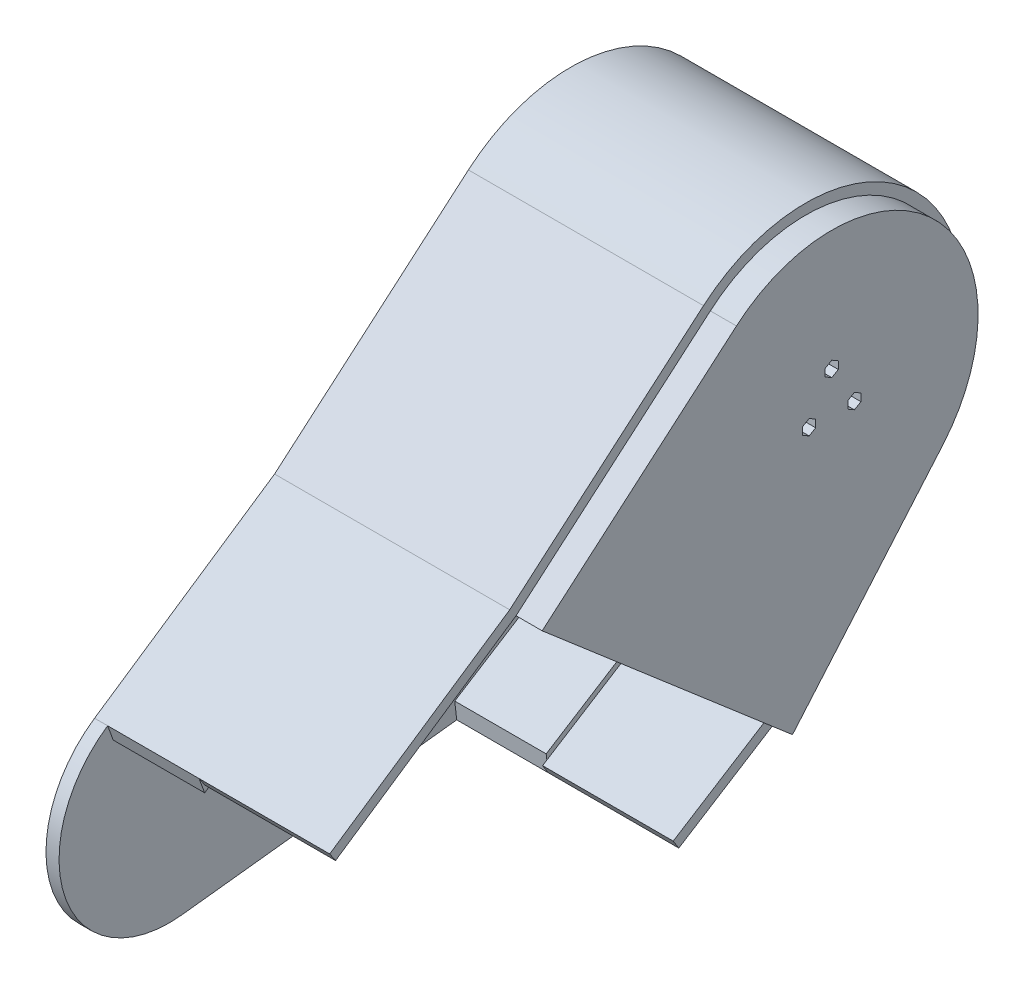
from build123d import *

# Parameters (mm, degrees)
EXTRUDE_1_DEPTH      = 40
CUT_EXTRUDE_4_DEPTH  = 35
SKETCH_7_W           = 35
SKETCH_7_H           = 105.918756423
CUT_EXTRUDE_5_DEPTH  = 15
CUT_EXTRUDE_START    = -35
CUT_EXTRUDE_9_DEPTH  = 35
CUT_EXTRUDE_10_DEPTH = 35
CUT_EXTRUDE_11_DEPTH = 10
EXTRUDE_1_2_DEPTH    = 50
EXTRUDE_2_DEPTH      = 10
CUT_EXTRUDE_12_DEPTH = 5


with BuildPart() as part:
    # 草图3 → Extrude 1 (new body)
    with BuildSketch(Plane(origin=(0, 0, 0), x_dir=(0, 0, -1), z_dir=(1, 0, 0))):
        with BuildLine():
            Line((-39.095806766, 45.513930761), (-113.284374472, -18.21297348))
            Line((-113.284374472, -18.21297348), (-182.19003676, -64.697864694))
            ThreePointArc((-182.19003676, -64.697864694), (-198.176247728, -114.294556788), (-153.795474112, -141.602755941))
            Line((-153.795474112, -141.602755941), (-48.562971232, -129.565177285))
            Line((-48.562971232, -129.565177285), (-12.389530407, -106.789307136))
            Line((-12.389530407, -106.789307136), (45.595100093, -39.001113414))
            ThreePointArc((45.595100093, -39.001113414), (42.382288475, 42.470479437), (-39.095806766, 45.513930761))
        make_face()
    extrude(amount=EXTRUDE_1_DEPTH)

    # 草图6 → 切除-拉伸4 (cut)
    with BuildSketch(Plane(origin=(40, 0, 0), x_dir=(0, 0, -1), z_dir=(1, 0, 0))):
        with BuildLine():
            Line((-35.186226089, 40.962537685), (-109.639530952, -22.991771937))
            Line((-109.639530952, -22.991771937), (-178.834510467, -69.671841302))
            ThreePointArc((-178.834510467, -69.671841302), (-192.547642974, -112.216382465), (-154.477369126, -135.641630276))
            Line((-154.477369126, -135.641630276), (-50.603031616, -123.759412579))
            Line((-50.603031616, -123.759412579), (-16.357071017, -102.19714109))
            Line((-16.357071017, -102.19714109), (41.035590084, -35.101002072))
            ThreePointArc((41.035590084, -35.101002072), (38.144059628, 38.223431493), (-35.186226089, 40.962537685))
        make_face()
    extrude(amount=-CUT_EXTRUDE_4_DEPTH, mode=Mode.SUBTRACT)

    # 草图7 → 切除-拉伸5 (cut)
    with BuildSketch(Plane(origin=(0, -122.40831364, -14.002324977), x_dir=(-1, 0, 0), z_dir=(0, -0.9935209441032395, -0.11364916906078788))):
        with Locations((-22.5, -115.932681977)):
            Rectangle(SKETCH_7_W, SKETCH_7_H)
    extrude(amount=-CUT_EXTRUDE_5_DEPTH, mode=Mode.SUBTRACT)

    # 草图10 → 切除-拉伸9 (cut)
    with BuildSketch(Plane(origin=(40, 0, 0), x_dir=(0, 0, -1), z_dir=(1, 0, 0)).offset(CUT_EXTRUDE_START)):
        with BuildLine():
            Line((-182.19003676, -64.697864694), (-153.795474112, -141.602755941))
            ThreePointArc((-153.795474112, -141.602755941), (-198.176247728, -114.294556788), (-182.19003676, -64.697864694))
        make_face()
    extrude(amount=CUT_EXTRUDE_9_DEPTH, mode=Mode.SUBTRACT)

    # 草图11 → 切除-拉伸10 (cut)
    with BuildSketch(Plane(origin=(40, 0, 0), x_dir=(0, 0, -1), z_dir=(1, 0, 0))):
        with BuildLine():
            Line((-153.795474112, -141.602755941), (-155.945574258, -135.779344608))
            ThreePointArc((-155.945574258, -135.779344608), (-155.210770318, -135.717964955), (-154.477369126, -135.641630276))
            Line((-154.477369126, -135.641630276), (-153.795474112, -141.602755941))
        make_face()
    extrude(amount=-CUT_EXTRUDE_10_DEPTH, mode=Mode.SUBTRACT)

    # 草图12 → 切除-拉伸11 (cut)
    with BuildSketch(Plane.ZY):
        with BuildLine():
            ThreePointArc((84.793520473, -96.572189119), (99.745010507, -105.858971316), (116.884057166, -101.853417992))
            ThreePointArc((116.884057166, -101.853417992), (118.032316505, -94.876205046), (111.055103559, -93.727945707))
            ThreePointArc((111.055103559, -93.727945707), (101.368894437, -95.991702141), (92.918992758, -90.743235512))
            ThreePointArc((92.918992758, -90.743235512), (85.941779812, -89.594976173), (84.793520473, -96.572189119))
        make_face()
    extrude(amount=-CUT_EXTRUDE_11_DEPTH, mode=Mode.SUBTRACT)

    # 草图14 → Extrude 1 2 (add)
    with BuildSketch(Plane(origin=(40, 0, 0), x_dir=(0, 0, -1), z_dir=(1, 0, 0))):
        with BuildLine():
            Line((-49.319536319, -122.95128591), (-16.357071017, -102.19714109))
            Line((-16.357071017, -102.19714109), (41.035590084, -35.101002072))
            ThreePointArc((41.035590084, -35.101002072), (38.144059628, 38.223431493), (-35.186226089, 40.962537685))
            Line((-35.186226089, 40.962537685), (-109.639530952, -22.991771937))
            Line((-109.639530952, -22.991771937), (-178.834510467, -69.671841302))
            Line((-178.834510467, -69.671841302), (-176.597492938, -72.987825708))
            Line((-176.597492938, -72.987825708), (-107.209635272, -26.177637574))
            Line((-107.209635272, -26.177637574), (-32.579838971, 37.928275634))
            ThreePointArc((-32.579838971, 37.928275634), (35.31857373, 35.392066197), (37.995916744, -32.500927845))
            Line((37.995916744, -32.500927845), (-19.00209809, -99.13569706))
            Line((-19.00209809, -99.13569706), (-51.450789398, -119.56635455))
            Line((-51.450789398, -119.56635455), (-49.319536319, -122.95128591))
        make_face()
        with BuildLine():
            Line((-48.562971232, -129.565177285), (-12.389530407, -106.789307136))
            Line((-12.389530407, -106.789307136), (45.595100093, -39.001113414))
            ThreePointArc((45.595100093, -39.001113414), (42.382288475, 42.470479437), (-39.095806766, 45.513930761))
            Line((-39.095806766, 45.513930761), (-113.284374472, -18.21297348))
            Line((-113.284374472, -18.21297348), (-182.19003676, -64.697864694))
            Line((-182.19003676, -64.697864694), (-179.953019231, -68.0138491))
            Line((-179.953019231, -68.0138491), (-110.854478792, -21.398839118))
            Line((-110.854478792, -21.398839118), (-36.489419648, 42.47966871))
            ThreePointArc((-36.489419648, 42.47966871), (39.556802577, 39.639114141), (42.555426753, -36.401039186))
            Line((42.555426753, -36.401039186), (-15.03455748, -103.727863106))
            Line((-15.03455748, -103.727863106), (-50.694224311, -126.180245925))
            Line((-50.694224311, -126.180245925), (-48.562971232, -129.565177285))
        make_face()
    extrude(amount=EXTRUDE_1_2_DEPTH)


with BuildPart() as extrude_1_2_kept_piece:
    # of the separate pieces the step leaves, the one the design keeps (extrude_1_2_pieces_kept)
    add(part.part.solids().sort_by_distance((90, 45.513930761, 39.095806766))[0])


with BuildPart() as body_2:
    # 草图15 → 凸台-拉伸2 (new body)
    with BuildSketch(Plane(origin=(90, 0, 0), x_dir=(0, 0, -1), z_dir=(1, 0, 0))):
        with BuildLine():
            Line((-15.03455748, -103.727863106), (42.555426753, -36.401039186))
            ThreePointArc((42.555426753, -36.401039186), (39.556802577, 39.639114141), (-36.489419648, 42.47966871))
            Line((-36.489419648, 42.47966871), (-110.854478792, -21.398839118))
            Line((-110.854478792, -21.398839118), (-15.03455748, -103.727863106))
        make_face()
    extrude(amount=EXTRUDE_2_DEPTH)

    # 草图16 → 切除-拉伸12 (cut)
    with BuildSketch(Plane(origin=(100, 0, 0), x_dir=(0, 0, -1), z_dir=(1, 0, 0))):
        Polygon((6.160254038, -3.556624327), (6.160254038, -6.443375673), (8.660254038, -7.886751346), (11.160254038, -6.443375673), (11.160254038, -3.556624327), (8.660254038, -2.113248654), align=None)
        Polygon((0, 7.113248654), (2.5, 8.556624327), (2.5, 11.443375673), (0, 12.886751346), (-2.5, 11.443375673), (-2.5, 8.556624327), align=None)
        Polygon((-6.160254038, -3.556624327), (-8.660254038, -2.113248654), (-11.160254038, -3.556624327), (-11.160254038, -6.443375673), (-8.660254038, -7.886751346), (-6.160254038, -6.443375673), align=None)
    extrude(amount=-CUT_EXTRUDE_12_DEPTH, mode=Mode.SUBTRACT)


solid = Compound([extrude_1_2_kept_piece.part, body_2.part])
